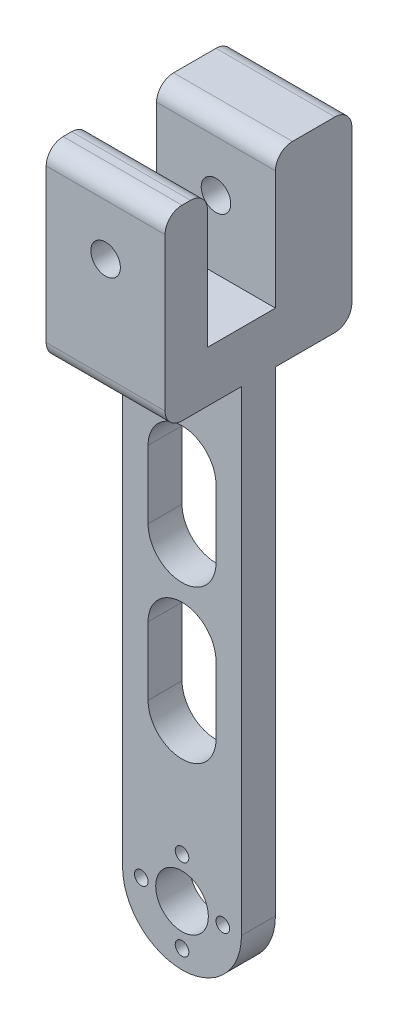
from build123d import *

# Parameters (mm, degrees)
BOSS_EXTRUDE1_DEPTH = 5
BOSS_EXTRUDE2_DEPTH = 17.5
CUT_EXTRUDE1_DEPTH  = 35
SKETCH13_R          = 4.35
CUT_EXTRUDE7_DEPTH  = 129.671092325
CUT_EXTRUDE2_DEPTH  = 10
CUT_EXTRUDE3_DEPTH  = 10
SKETCH9_R           = 7.75
SKETCH9_R_2         = 2
CUT_EXTRUDE4_DEPTH  = 121.778723292


with BuildPart() as part:
    # Sketch2 → Boss-Extrude1 (new, symmetric)
    with BuildSketch(Plane.XY):
        with BuildLine():
            Line((17.5, 97.5), (-17.5, 97.5))
            Line((-17.5, 97.5), (-17.5, -97.5))
            ThreePointArc((-17.5, -97.5), (0, -115), (17.5, -97.5))
            Line((17.5, -97.5), (17.5, 97.5))
        make_face()
    extrude(amount=BOSS_EXTRUDE1_DEPTH, both=True)

    # Sketch3 → Boss-Extrude2 (add, symmetric)
    with BuildSketch(Plane(origin=(0, 0, 0), x_dir=(0, 0, -1), z_dir=(1, 0, 0))):
        with BuildLine():
            Line((-22.5, 97.5), (22.5, 97.5))
            ThreePointArc((22.5, 97.5), (26.035533906, 96.035533906), (27.5, 92.5))
            Line((27.5, 92.5), (27.5, 47.5))
            ThreePointArc((27.5, 47.5), (26.035533906, 43.964466094), (22.5, 42.5))
            Line((22.5, 42.5), (-22.5, 42.5))
            ThreePointArc((-22.5, 42.5), (-26.035533906, 43.964466094), (-27.5, 47.5))
            Line((-27.5, 47.5), (-27.5, 92.5))
            ThreePointArc((-27.5, 92.5), (-26.035533906, 96.035533906), (-22.5, 97.5))
        make_face()
    extrude(amount=BOSS_EXTRUDE2_DEPTH, both=True)

    # Sketch4 → Cut-Extrude1 (cut)
    with BuildSketch(Plane.ZY.offset(17.5)):
        with BuildLine():
            Line((-5, 92.5), (-5, 57.5))
            Line((-5, 57.5), (15, 57.5))
            Line((15, 57.5), (15, 92.5))
            ThreePointArc((15, 92.5), (16.464466094, 96.035533906), (20, 97.5))
            Line((20, 97.5), (-10, 97.5))
            ThreePointArc((-10, 97.5), (-6.464466094, 96.035533906), (-5, 92.5))
        make_face()
    extrude(amount=-CUT_EXTRUDE1_DEPTH, mode=Mode.SUBTRACT)

    # Sketch13 → Cut-Extrude7 (cut, through all)
    with BuildSketch(Plane(origin=(0, 0, -27.5), x_dir=(-1, 0, 0), z_dir=(0, 0, -1))):
        with Locations(Location((0, 77.5, 0), (0, 0, 90))):
            Circle(SKETCH13_R)
    extrude(amount=-CUT_EXTRUDE7_DEPTH, mode=Mode.SUBTRACT)

    # Sketch5 → Cut-Extrude2 (cut)
    with BuildSketch(Plane.XY.offset(5)):
        with BuildLine():
            Line((10, 13.756181567), (10, -6.243818433))
            ThreePointArc((10, -6.243818433), (0, -16.243818433), (-10, -6.243818433))
            Line((-10, -6.243818433), (-10, 13.756181567))
            ThreePointArc((-10, 13.756181567), (0, 23.756181567), (10, 13.756181567))
        make_face()
        with BuildLine():
            Line((10, -31.243818433), (10, -51.243818433))
            ThreePointArc((10, -51.243818433), (0, -61.243818433), (-10, -51.243818433))
            Line((-10, -51.243818433), (-10, -31.243818433))
            ThreePointArc((-10, -31.243818433), (0, -21.243818433), (10, -31.243818433))
        make_face()
    cut_extrude2 = extrude(amount=-CUT_EXTRUDE2_DEPTH, mode=Mode.SUBTRACT)

    # Mirror1: Cut-Extrude2 across plane
    add(cut_extrude2.mirror(Plane.XY), mode=Mode.SUBTRACT)

    # Sketch8 → Cut-Extrude3 (cut)
    with BuildSketch(Plane.XY.offset(5)):
        with BuildLine():
            Line((5, 13.756181567), (5, -6.243818433))
            ThreePointArc((5, -6.243818433), (0, -11.243818433), (-5, -6.243818433))
            Line((-5, -6.243818433), (-5, 13.756181567))
            ThreePointArc((-5, 13.756181567), (0, 18.756181567), (5, 13.756181567))
        make_face()
        with BuildLine():
            Line((-5, -31.243818433), (-5, -51.243818433))
            ThreePointArc((-5, -51.243818433), (0, -56.243818433), (5, -51.243818433))
            Line((5, -51.243818433), (5, -31.243818433))
            ThreePointArc((5, -31.243818433), (0, -26.243818433), (-5, -31.243818433))
        make_face()
    extrude(amount=-CUT_EXTRUDE3_DEPTH, mode=Mode.SUBTRACT)

    # Sketch9 → Cut-Extrude4 (cut, through all)
    with BuildSketch(Plane(origin=(0, 0, -5), x_dir=(-1, 0, 0), z_dir=(0, 0, -1))):
        with Locations((0, -97.5)):
            Circle(SKETCH9_R)
        with Locations((12, -97.5)):
            Circle(SKETCH9_R_2)
        with Locations((0, -109.5)):
            Circle(SKETCH9_R_2)
        with Locations((-12, -97.5)):
            Circle(SKETCH9_R_2)
        with Locations((0, -85.5)):
            Circle(SKETCH9_R_2)
    extrude(amount=-CUT_EXTRUDE4_DEPTH, mode=Mode.SUBTRACT)


solid = part.part
